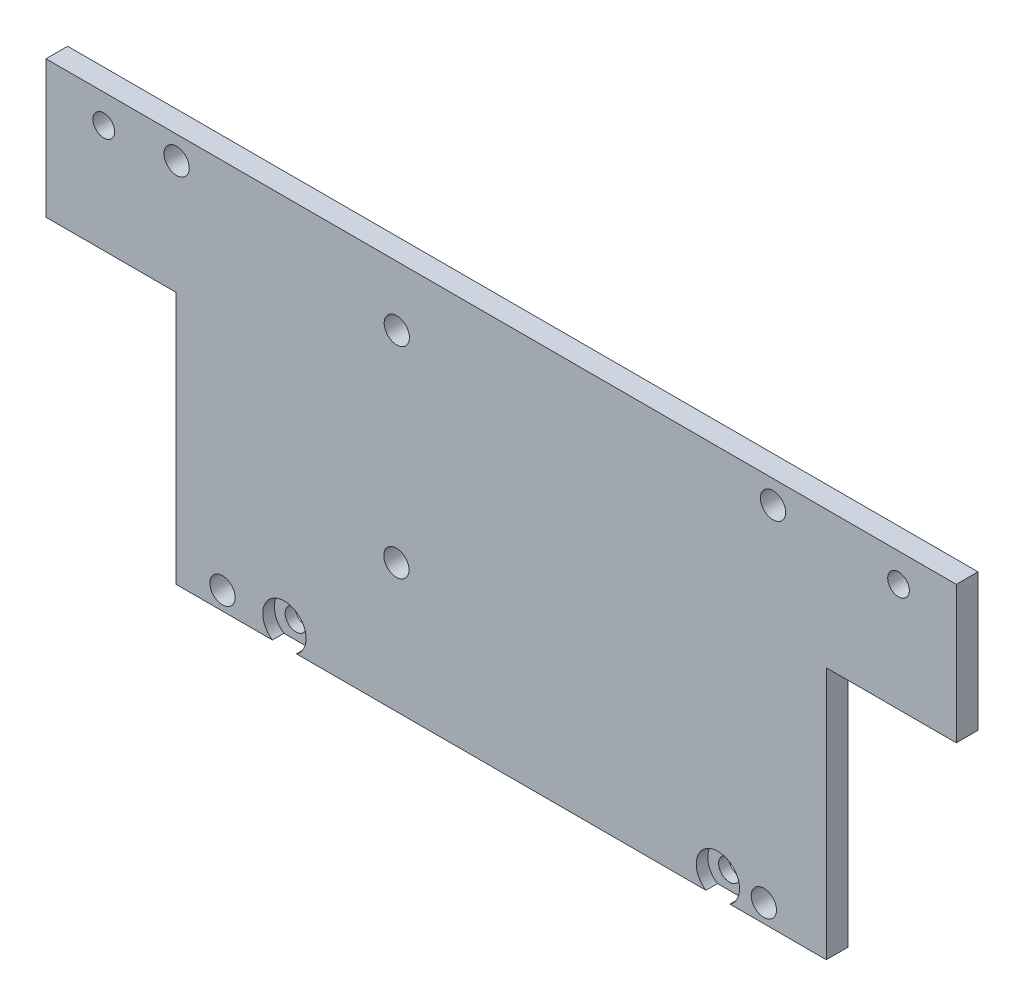
from build123d import *

# Parameters (mm, degrees)
SKETCH1_W           = 150
SKETCH1_H           = 54
BOSS_EXTRUDE1_DEPTH = 3
SKETCH2_W           = 30
SKETCH2_H           = 35
CUT_EXTRUDE1_DEPTH  = 160.452187191
SKETCH4_W           = 12
SKETCH4_H           = 19
CUT_EXTRUDE2_DEPTH  = 3
SKETCH5_R           = 1.5
CUT_EXTRUDE3_DEPTH  = 3
SKETCH7_R           = 3
CUT_EXTRUDE5_DEPTH  = 1.6
SKETCH8_R           = 1.75
CUT_EXTRUDE6_DEPTH  = 3


with BuildPart() as part:
    # Sketch1 → Boss-Extrude1 (new body)
    with BuildSketch(Plane.XY):
        with Locations((75, 27)):
            Rectangle(SKETCH1_W, SKETCH1_H)
    extrude(amount=BOSS_EXTRUDE1_DEPTH)

    # Sketch2 → Cut-Extrude1 (cut, through all)
    with BuildSketch(Plane(origin=(0, 0, 0), x_dir=(-1, 0, 0), z_dir=(0, 0, -1))):
        with Locations((-15, 17.5)):
            Rectangle(SKETCH2_W, SKETCH2_H)
        with Locations((-135, 17.5)):
            Rectangle(SKETCH2_W, SKETCH2_H)
    extrude(amount=-CUT_EXTRUDE1_DEPTH, mode=Mode.SUBTRACT)

    # Sketch4 → Cut-Extrude2 (cut)
    with BuildSketch(Plane(origin=(0, 0, 0), x_dir=(-1, 0, 0), z_dir=(0, 0, -1))):
        with Locations((-144, 44.5)):
            Rectangle(SKETCH4_W, SKETCH4_H)
        with Locations((-6, 44.5)):
            Rectangle(SKETCH4_W, SKETCH4_H)
    extrude(amount=-CUT_EXTRUDE2_DEPTH, mode=Mode.SUBTRACT)

    # Sketch5 → Cut-Extrude3 (cut)
    with BuildSketch(Plane(origin=(0, 0, 0), x_dir=(-1, 0, 0), z_dir=(0, 0, -1))):
        with Locations((-130, 50)):
            Circle(SKETCH5_R)
        with Locations((-105, 2.5)):
            Circle(SKETCH5_R)
        with Locations(Location((-45, 2.5, 0), (0, 0, 180))):
            Circle(SKETCH5_R)
        with Locations(Location((-20, 50, 0), (0, 0, 180))):
            Circle(SKETCH5_R)
    extrude(amount=-CUT_EXTRUDE3_DEPTH, mode=Mode.SUBTRACT)

    # Sketch7 → Cut-Extrude5 (cut)
    with BuildSketch(Plane.XY.offset(3)):
        with Locations((45, 2.5)):
            Circle(SKETCH7_R)
        with Locations((105, 2.5)):
            Circle(SKETCH7_R)
    extrude(amount=-CUT_EXTRUDE5_DEPTH, mode=Mode.SUBTRACT)

    # Sketch8 → Cut-Extrude6 (cut)
    with BuildSketch(Plane.XY.offset(3)):
        with Locations((30.08, 50.8)):
            Circle(SKETCH8_R)
        with Locations((60.56, 45.72)):
            Circle(SKETCH8_R)
        with Locations((60.5, 17.84)):
            Circle(SKETCH8_R)
        with Locations((36.43, 2.5)):
            Circle(SKETCH8_R)
        with Locations((111.36, 2.5)):
            Circle(SKETCH8_R)
        with Locations((112.63, 50.8)):
            Circle(SKETCH8_R)
    extrude(amount=-CUT_EXTRUDE6_DEPTH, mode=Mode.SUBTRACT)


solid = part.part
